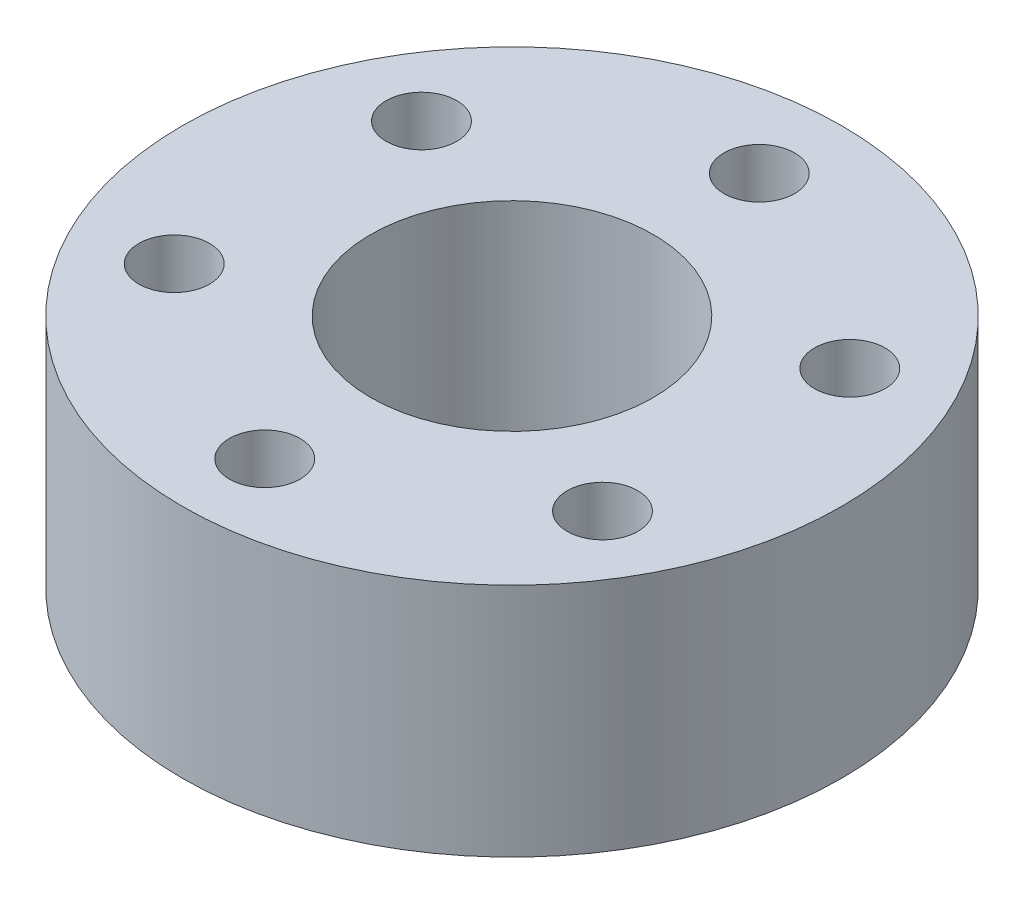
from build123d import *

# Parameters (mm, degrees)
SKETCH1_R           = 14
BOSS_EXTRUDE1_DEPTH = 10
SKETCH2_R           = 1.5
SKETCH2_R_2         = 6
CUT_EXTRUDE1_DEPTH  = 23.181073013


with BuildPart() as part:
    # Sketch1 → Boss-Extrude1 (new body)
    with BuildSketch(Plane(origin=(0, 0, 0), x_dir=(1, 0, 0), z_dir=(0, 1, 0))):
        with Locations(Location((0, 0, 0), (0, 0, 270))):
            Circle(SKETCH1_R)
    extrude(amount=BOSS_EXTRUDE1_DEPTH)

    # Sketch2 → Cut-Extrude1 (cut, through all)
    with BuildSketch(Plane(origin=(0, 10, 0), x_dir=(1, 0, 0), z_dir=(0, 1, 0))):
        with Locations(Location((0, 10.5, 0), (0, 0, 270))):
            Circle(SKETCH2_R)
        with Locations(Location((0, 0, 0), (0, 0, 270))):
            Circle(SKETCH2_R_2)
        with Locations(Location((9.09326674, 5.25, 0), (0, 0, 270))):
            Circle(SKETCH2_R)
        with Locations(Location((9.09326674, -5.25, 0), (0, 0, 270))):
            Circle(SKETCH2_R)
        with Locations(Location((0, -10.5, 0), (0, 0, 270))):
            Circle(SKETCH2_R)
        with Locations(Location((-9.09326674, -5.25, 0), (0, 0, 270))):
            Circle(SKETCH2_R)
        with Locations(Location((-9.09326674, 5.25, 0), (0, 0, 270))):
            Circle(SKETCH2_R)
    extrude(amount=-CUT_EXTRUDE1_DEPTH, mode=Mode.SUBTRACT)


solid = part.part
